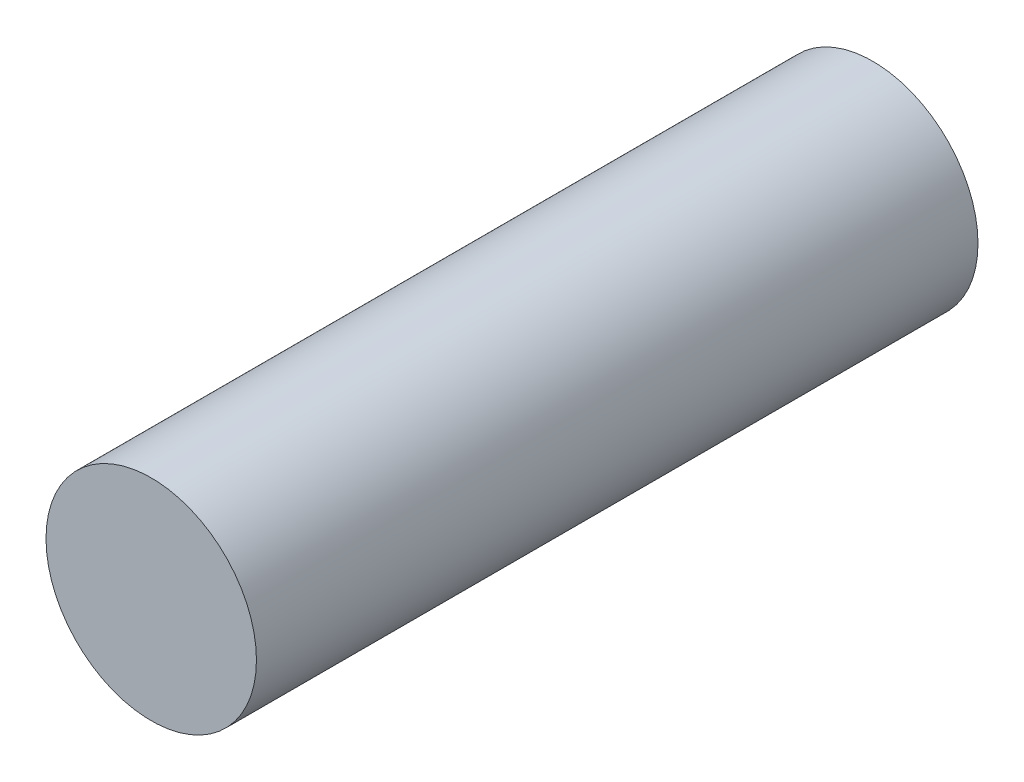
from build123d import *

# Parameters (mm, degrees)
SKETCH1_R           = 17.5
BOSS_EXTRUDE1_DEPTH = 120


with BuildPart() as part:
    # Sketch1 → Boss-Extrude1 (new body)
    with BuildSketch(Plane.XY):
        Circle(SKETCH1_R)
    extrude(amount=BOSS_EXTRUDE1_DEPTH)


solid = part.part
